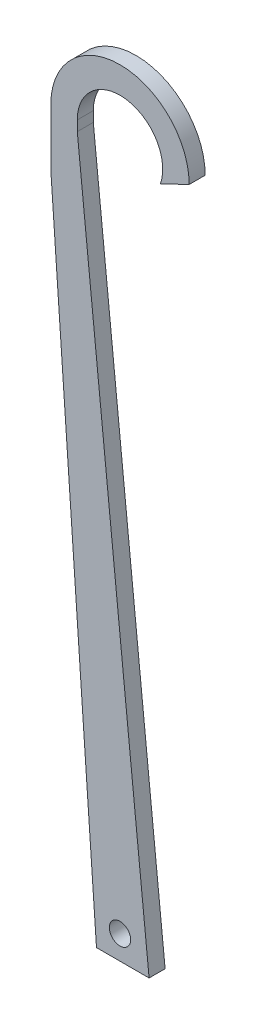
from build123d import *

# Parameters (mm, degrees)
SKETCH1_R           = 6.35
BOSS_EXTRUDE1_DEPTH = 9.525


with BuildPart() as part:
    # Sketch1 → Boss-Extrude1 (new body)
    with BuildSketch(Plane.XY):
        with BuildLine():
            Line((-25.4, 0), (-25.4, -6.052924625))
            Line((-25.4, -6.052924625), (17.310584604, -420.580806397))
            Line((17.310584604, -420.580806397), (-13.977037286, -420.580806397))
            Line((-13.977037286, -420.580806397), (-41.144220181, -33.731534677))
            Line((-41.144220181, -33.731534677), (-41.144220181, 0))
            ThreePointArc((-41.144220181, 0), (0, 41.144220181), (41.144220181, 0))
            Line((41.144220181, 0), (24.031627115, -8.224408685))
            ThreePointArc((24.031627115, -8.224408685), (25.055571523, -4.168733098), (25.4, 0))
            ThreePointArc((25.4, 0), (0, 25.4), (-25.4, 0))
        make_face()
        with Locations(Location((0, -406.4, 0), (0, 0, 180))):
            Circle(SKETCH1_R, mode=Mode.SUBTRACT)
    extrude(amount=BOSS_EXTRUDE1_DEPTH)


solid = part.part
